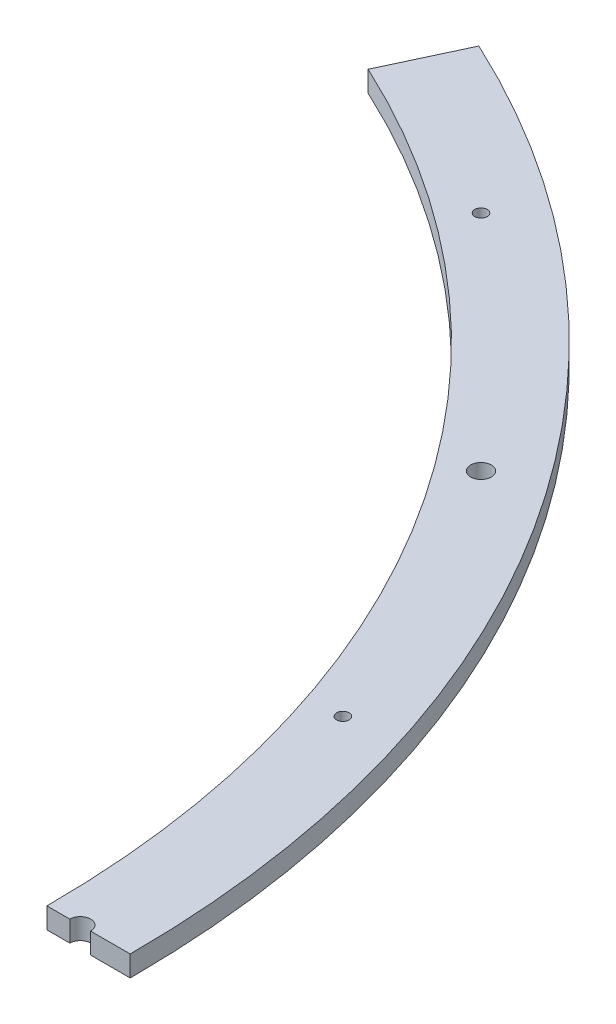
from build123d import *

# Parameters (mm, degrees)
SKETCH1_R           = 254.5
SKETCH1_R_2         = 234.5
BOSS_EXTRUDE1_DEPTH = 5
SKETCH2_W           = 27.805822748
SKETCH2_H           = 60
CUT_EXTRUDE1_DEPTH  = 5
SKETCH3_R           = 2.5
CUT_EXTRUDE2_DEPTH  = 5
SKETCH4_R           = 1.5
CUT_EXTRUDE3_DEPTH  = 5
SKETCH5_W           = 651.212620435
SKETCH5_H           = 357.226439325
CUT_EXTRUDE4_DEPTH  = 10
CUT_EXTRUDE9_START  = -10
SKETCH6_R           = 1.5
SKETCH6_R_2         = 2.5
CUT_EXTRUDE9_DEPTH  = 10
SKETCH7_R           = 2.5
SKETCH7_R_2         = 1.5
CUT_EXTRUDE11_DEPTH = 10


with BuildPart() as part:
    # Sketch1 → Boss-Extrude1 (new body)
    with BuildSketch(Plane(origin=(0, 0, 0), x_dir=(1, 0, 0), z_dir=(0, 1, 0))):
        with Locations(Location((0, 0, 0), (0, 0, 270))):
            Circle(SKETCH1_R)
        with Locations(Location((0, 0, 0), (0, 0, 270))):
            Circle(SKETCH1_R_2, mode=Mode.SUBTRACT)
    extrude(amount=BOSS_EXTRUDE1_DEPTH)

    # Sketch2 → Cut-Extrude1 (cut)
    with BuildSketch(Plane(origin=(0, 5, 0), x_dir=(1, 0, 0), z_dir=(0, 1, 0))):
        with Locations((-240.597088626, 30)):
            Rectangle(SKETCH2_W, SKETCH2_H)
    cut_extrude1 = extrude(amount=-CUT_EXTRUDE1_DEPTH, mode=Mode.SUBTRACT)

    # Mirror1: Cut-Extrude1 across plane
    add(cut_extrude1.mirror(Plane.XY), mode=Mode.SUBTRACT)

    # Sketch3 → Cut-Extrude2 (cut)
    with BuildSketch(Plane(origin=(0, 5, 0), x_dir=(1, 0, 0), z_dir=(0, 1, 0))):
        with Locations(Location((242.5, 0, 0), (0, 0, 270))):
            Circle(SKETCH3_R)
        with Locations(Location((196.186621136, -142.537923681, 0), (0, 0, 270))):
            Circle(SKETCH3_R)
        with Locations(Location((74.936621136, -230.631205202, 0), (0, 0, 270))):
            Circle(SKETCH3_R)
        with Locations(Location((-74.936621136, -230.631205202, 0), (0, 0, 270))):
            Circle(SKETCH3_R)
        with Locations(Location((-196.186621136, -142.537923681, 0), (0, 0, 270))):
            Circle(SKETCH3_R)
        with Locations((-242.5, 0)):
            Circle(SKETCH3_R)
        with Locations(Location((-196.186621136, 142.537923681, 0), (0, 0, 270))):
            Circle(SKETCH3_R)
        with Locations(Location((-74.936621136, 230.631205202, 0), (0, 0, 270))):
            Circle(SKETCH3_R)
        with Locations(Location((74.936621136, 230.631205202, 0), (0, 0, 270))):
            Circle(SKETCH3_R)
        with Locations(Location((196.186621136, 142.537923681, 0), (0, 0, 270))):
            Circle(SKETCH3_R)
    extrude(amount=-CUT_EXTRUDE2_DEPTH, mode=Mode.SUBTRACT)

    # Sketch4 → Cut-Extrude3 (cut)
    with BuildSketch(Plane(origin=(0, 5, 0), x_dir=(1, 0, 0), z_dir=(0, 1, 0))):
        with Locations(Location((0, -242.5, 0), (0, 0, 270))):
            Circle(SKETCH4_R)
        with Locations(Location((-142.537923681, -196.186621136, 0), (0, 0, 270))):
            Circle(SKETCH4_R)
        with Locations(Location((-230.631205202, -74.936621136, 0), (0, 0, 270))):
            Circle(SKETCH4_R)
        with Locations(Location((-230.631205202, 74.936621136, 0), (0, 0, 270))):
            Circle(SKETCH4_R)
        with Locations(Location((-142.537923681, 196.186621136, 0), (0, 0, 270))):
            Circle(SKETCH4_R)
        with Locations(Location((0, 242.5, 0), (0, 0, 270))):
            Circle(SKETCH4_R)
        with Locations(Location((142.537923681, 196.186621136, 0), (0, 0, 270))):
            Circle(SKETCH4_R)
        with Locations(Location((230.631205202, 74.936621136, 0), (0, 0, 270))):
            Circle(SKETCH4_R)
        with Locations(Location((230.631205202, -74.936621136, 0), (0, 0, 270))):
            Circle(SKETCH4_R)
        with Locations(Location((142.537923681, -196.186621136, 0), (0, 0, 270))):
            Circle(SKETCH4_R)
    extrude(amount=-CUT_EXTRUDE3_DEPTH, mode=Mode.SUBTRACT)

    # Sketch5 → Cut-Extrude4 (cut)
    with BuildSketch(Plane(origin=(0, 5, 0), x_dir=(1, 0, 0), z_dir=(0, 1, 0))):
        with Locations((-71.106310217, -178.613219663)):
            Rectangle(SKETCH5_W, SKETCH5_H)
    extrude(amount=-CUT_EXTRUDE4_DEPTH, mode=Mode.SUBTRACT)

    # Sketch6 → Cut-Extrude9 (cut)
    # profile 1 of 2: a face of its own
    with BuildSketch(Plane(origin=(0, 5, 0), x_dir=(1, 0, 0), z_dir=(0, 1, 0)).offset(CUT_EXTRUDE9_START)):
        with BuildLine():
            Line((-117.25, 203.082957187), (-127.25, 220.403465263))
            ThreePointArc((-127.25, 220.403465263), (-203.737945948, 152.51589878), (-247.326201604, 60))
            Line((-247.326201604, 60), (-226.694177252, 60))
            ThreePointArc((-226.694177252, 60), (-186.259449225, 142.469883043), (-117.25, 203.082957187))
        make_face()
        with Locations((-230.631205202, 74.936621136)):
            Circle(SKETCH6_R, mode=Mode.SUBTRACT)
        with Locations((-196.186621136, 142.537923681)):
            Circle(SKETCH6_R_2, mode=Mode.SUBTRACT)
        with Locations((-142.537923681, 196.186621136)):
            Circle(SKETCH6_R, mode=Mode.SUBTRACT)
    # profile 2 of 2: a face of its own
    with BuildSketch(Plane(origin=(0, 5, 0), x_dir=(1, 0, 0), z_dir=(0, 1, 0)).offset(CUT_EXTRUDE9_START)):
        with BuildLine():
            Line((-254.5, 0), (0, 0))
            Line((0, 0), (-117.25, 203.082957187))
            ThreePointArc((-117.25, 203.082957187), (-186.259449225, 142.469883043), (-226.694177252, 60))
            Line((-226.694177252, 60), (-247.326201604, 60))
            ThreePointArc((-247.326201604, 60), (-252.700186296, 30.213669851), (-254.5, 0))
        make_face()
    extrude(amount=CUT_EXTRUDE9_DEPTH, mode=Mode.SUBTRACT)

    # Sketch7 → Cut-Extrude11 (cut)
    # profile 1 of 2: a face of its own
    with BuildSketch(Plane(origin=(0, 5, 0), x_dir=(1, 0, 0), z_dir=(0, 1, 0))):
        with BuildLine():
            Line((99.103982378, 212.52917606), (107.556347613, 230.655331801))
            ThreePointArc((107.556347613, 230.655331801), (-11.101134084, 254.257772393), (-127.25, 220.403465263))
            Line((-127.25, 220.403465263), (-117.25, 203.082957187))
            ThreePointArc((-117.25, 203.082957187), (-10.228746337, 234.276807961), (99.103982378, 212.52917606))
        make_face()
        with Locations((-74.936621136, 230.631205202)):
            Circle(SKETCH7_R, mode=Mode.SUBTRACT)
        with Locations((0, 242.5)):
            Circle(SKETCH7_R_2, mode=Mode.SUBTRACT)
        with Locations((74.936621136, 230.631205202)):
            Circle(SKETCH7_R, mode=Mode.SUBTRACT)
    # profile 2 of 2: a face of its own
    with BuildSketch(Plane(origin=(0, 5, 0), x_dir=(1, 0, 0), z_dir=(0, 1, 0))):
        with BuildLine():
            Line((-117.25, 203.082957187), (0, 0))
            Line((0, 0), (99.103982378, 212.52917606))
            ThreePointArc((99.103982378, 212.52917606), (-10.228746337, 234.276807961), (-117.25, 203.082957187))
        make_face()
    extrude(amount=-CUT_EXTRUDE11_DEPTH, mode=Mode.SUBTRACT)


solid = part.part
